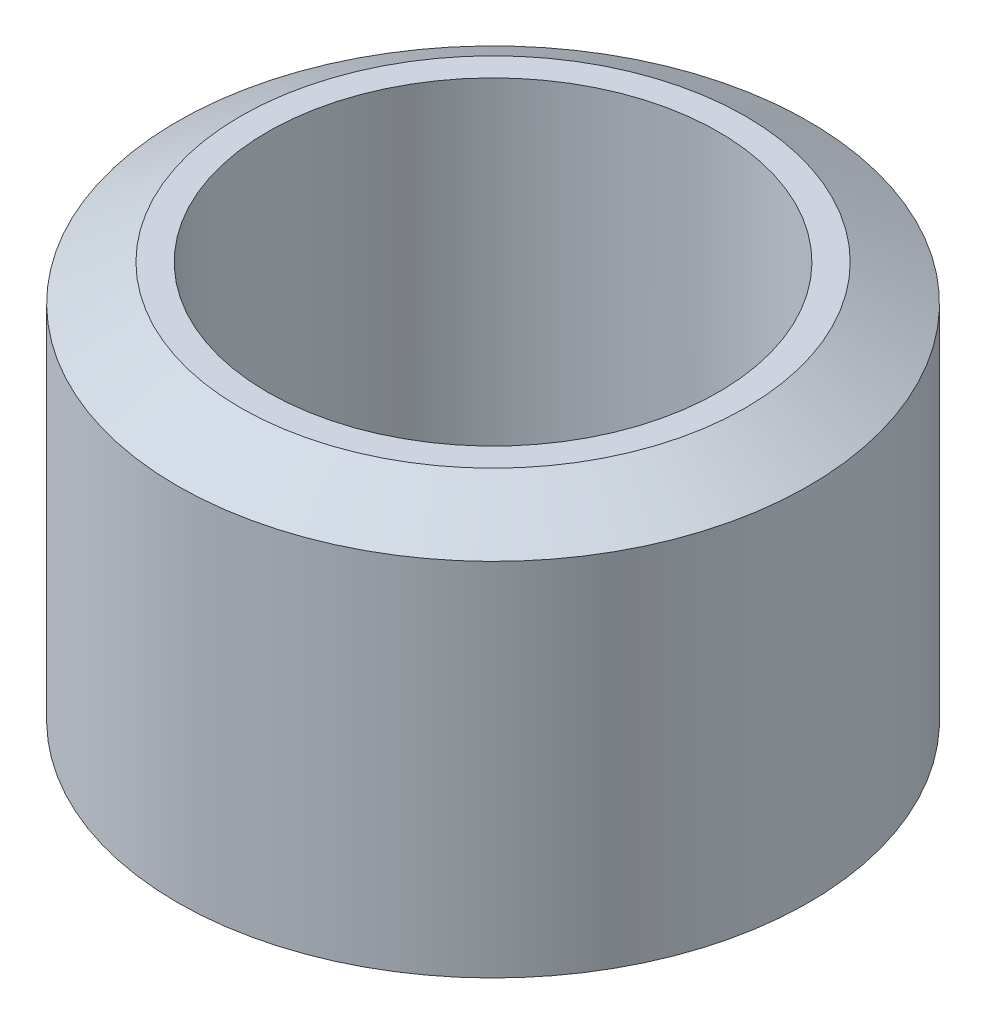
from build123d import *

# Parameters (mm, degrees)
SKETCH_1_R          = 8.75
EXTRUDE_1_DEPTH     = 10
CUT_EXTRUDE_1_REACH = 17.91
SKETCH_2_R          = 6.25
EXTRUDE_START       = 1
SKETCH_3_R          = 7
SKETCH_3_R_2        = 6.25
EXTRUDE_2_DEPTH     = 1
SKETCH_4_R          = 7
SKETCH_4_R_2        = 6.25
EXTRUDE_3_DEPTH     = 1


with BuildPart() as part:
    # 草图1 → 凸台-拉伸1 (new body)
    with BuildSketch(Plane(origin=(0, 0, 0), x_dir=(1, 0, 0), z_dir=(0, 1, 0))):
        with Locations(Location((0, 0, 0), (0, 0, 270))):
            Circle(SKETCH_1_R)
    extrude(amount=EXTRUDE_1_DEPTH)

    # 草图2 → 切除-拉伸1 (cut, up to next)
    with BuildSketch(Plane(origin=(0, 10, 0), x_dir=(1, 0, 0), z_dir=(0, 1, 0)), mode=Mode.PRIVATE) as cut_extrude_1_sk1:
        with Locations(Location((0, 0, 0), (0, 0, 270))):
            Circle(SKETCH_2_R)
    cut_extrude_1_tool1 = extrude(cut_extrude_1_sk1.sketch, amount=-CUT_EXTRUDE_1_REACH, mode=Mode.PRIVATE) & part.part
    add(cut_extrude_1_tool1.solids().sort_by_distance((0, 10, 0))[0], mode=Mode.SUBTRACT)

    # 草图3 → 凸台-拉伸2 (add)
    with BuildSketch(Plane(origin=(0, 10, 0), x_dir=(1, 0, 0), z_dir=(0, 1, 0)).offset(EXTRUDE_START)):
        with Locations(Location((0, 0, 0), (0, 0, 270))):
            Circle(SKETCH_3_R)
        with Locations(Location((0, 0, 0), (0, 0, 270))):
            Circle(SKETCH_3_R_2, mode=Mode.SUBTRACT)
    extrude(amount=-EXTRUDE_2_DEPTH)

    # 草图4 → 凸台-拉伸3 (add)
    with BuildSketch(Plane.XZ):
        with Locations(Location((0, 0, 0), (0, 0, 90))):
            Circle(SKETCH_4_R)
        with Locations(Location((0, 0, 0), (0, 0, 90))):
            Circle(SKETCH_4_R_2, mode=Mode.SUBTRACT)
    extrude(amount=EXTRUDE_3_DEPTH)

    # 草图5 → 旋转1 (revolve)
    with BuildSketch(Plane.XY, mode=Mode.PRIVATE) as revolve_1_sk:
        Polygon((-7, 11), (-8.75, 10), (-7, 10), align=None)
        Polygon((-8.75, 0), (-7, 0), (-7, -1), align=None)
    revolve(revolve_1_sk.sketch.rotate(Axis((0, 12.096395085, 0), (0, -1, 0)), 270), axis=Axis((0, 12.096395085, 0), (0, -1, 0)))


solid = part.part
